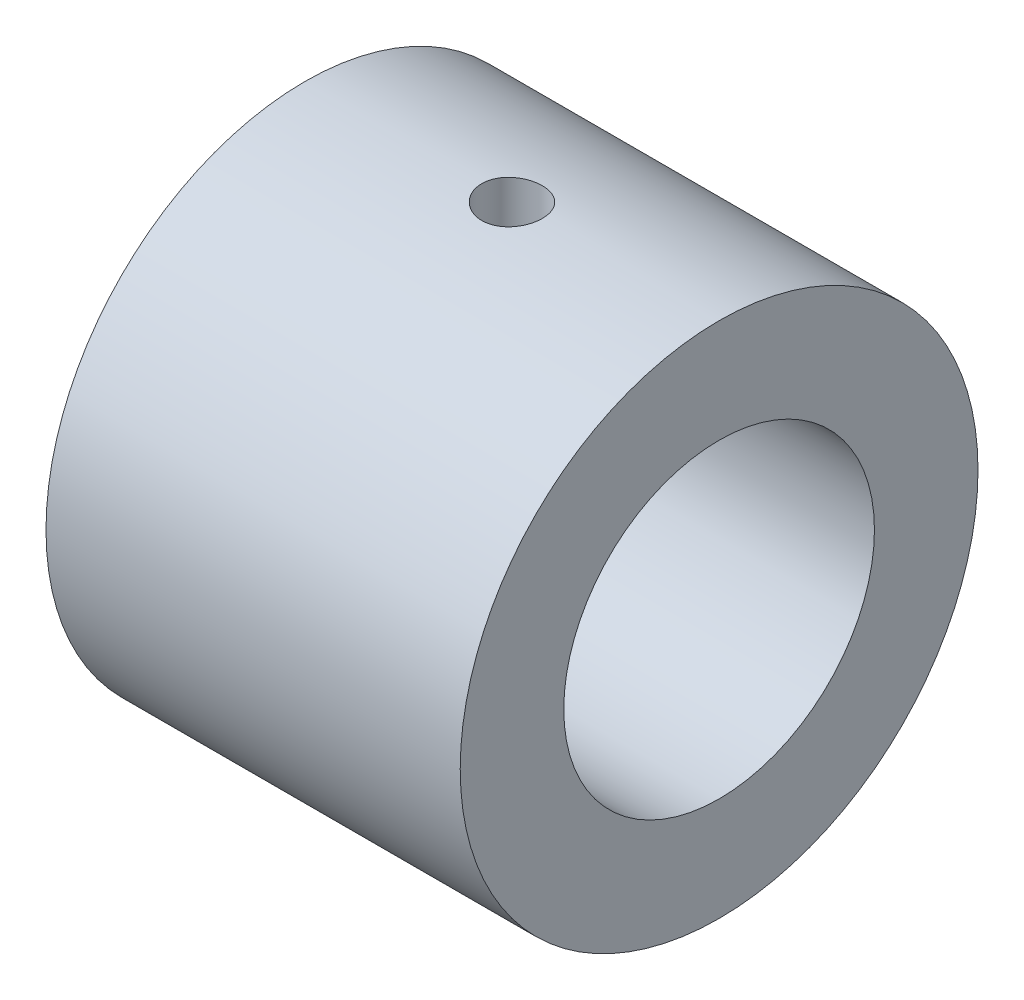
from build123d import *

# Parameters (mm, degrees)
SKETCH1_R           = 15.875
BOSS_EXTRUDE1_DEPTH = 12.7
SKETCH2_R           = 9.525
F_3_4_REAM_DEPTH    = 34.89972345
SKETCH3_R           = 1.8542
F_10_32_TAP_DEPTH   = 26.793821935


with BuildPart() as part:
    # Sketch1 → Boss-Extrude1 (new, symmetric)
    with BuildSketch(Plane(origin=(0, 0, 0), x_dir=(0, 0, -1), z_dir=(1, 0, 0))):
        Circle(SKETCH1_R)
    extrude(amount=BOSS_EXTRUDE1_DEPTH, both=True)

    # Sketch2 → 3/4 Ream (cut, through all)
    with BuildSketch(Plane(origin=(12.7, 0, 0), x_dir=(0, 0, -1), z_dir=(1, 0, 0))):
        Circle(SKETCH2_R)
    extrude(amount=-F_3_4_REAM_DEPTH, mode=Mode.SUBTRACT)

    # Sketch3 → #10-32 Tap (cut, through all)
    with BuildSketch(Plane(origin=(0, 0, 0), x_dir=(1, 0, 0), z_dir=(0, 1, 0))):
        with Locations(Location((0, 0, 0), (0, 0, 90))):
            Circle(SKETCH3_R)
    extrude(amount=F_10_32_TAP_DEPTH, mode=Mode.SUBTRACT)


solid = part.part
